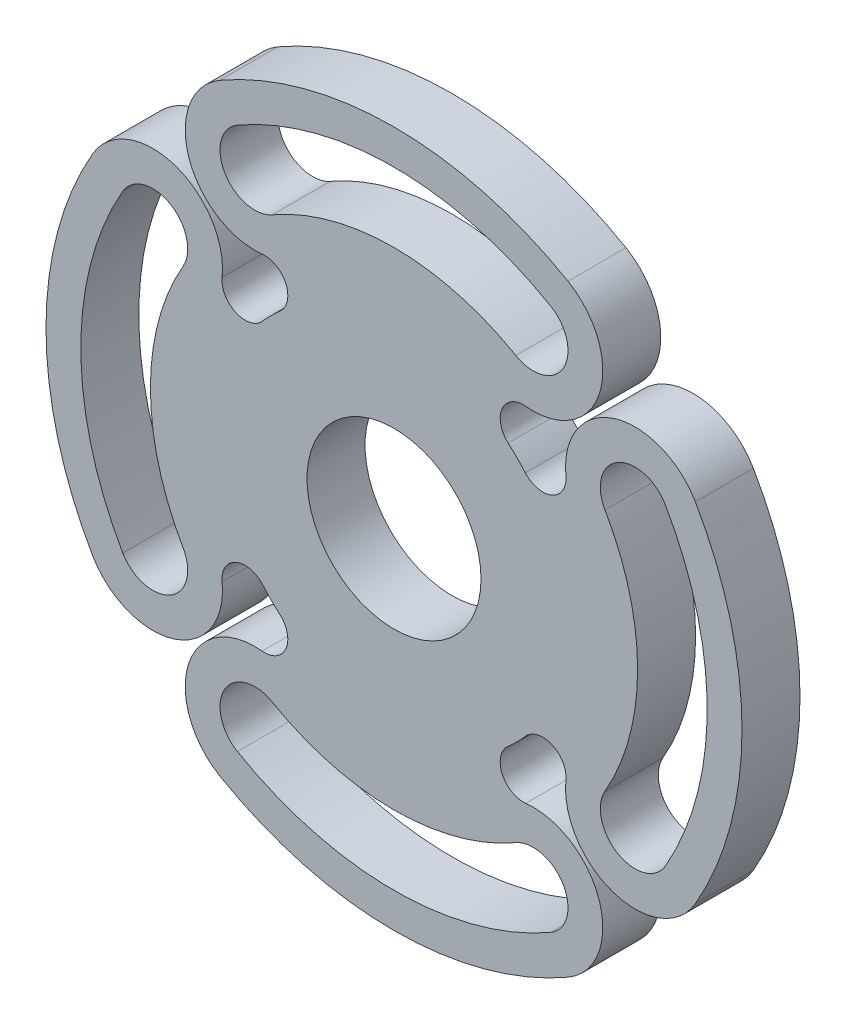
from build123d import *

# Parameters (mm, degrees)
SKETCH2_R           = 15
BOSS_EXTRUDE1_DEPTH = 5


with BuildPart() as part:
    # Sketch2 → Boss-Extrude1 (new, symmetric)
    with BuildSketch(Plane.XY):
        with BuildLine():
            ThreePointArc((-22.73046694, 29.636563105), (-18.64010484, 27.256433461), (-19.682902282, 22.640303835))
            ThreePointArc((-19.682902282, 22.640303835), (-21.213203436, 21.213203436), (-22.640303835, 19.682902282))
            ThreePointArc((-22.640303835, 19.682902282), (-27.256433461, 18.64010484), (-29.636563105, 22.73046694))
            ThreePointArc((-29.636563105, 22.73046694), (-37.853751933, 35.41031558), (-51.961524227, 30))
            ThreePointArc((-51.961524227, 30), (-60, 0), (-51.961524227, -30))
            ThreePointArc((-51.961524227, -30), (-37.853751933, -35.41031558), (-29.636563105, -22.73046694))
            ThreePointArc((-29.636563105, -22.73046694), (-27.256433461, -18.64010484), (-22.640303835, -19.682902282))
            ThreePointArc((-22.640303835, -19.682902282), (-21.213203436, -21.213203436), (-19.682902282, -22.640303835))
            ThreePointArc((-19.682902282, -22.640303835), (-18.64010484, -27.256433461), (-22.73046694, -29.636563105))
            ThreePointArc((-22.73046694, -29.636563105), (-35.41031558, -37.853751933), (-30, -51.961524227))
            ThreePointArc((-30, -51.961524227), (0, -60), (30, -51.961524227))
            ThreePointArc((30, -51.961524227), (35.41031558, -37.853751933), (22.73046694, -29.636563105))
            ThreePointArc((22.73046694, -29.636563105), (18.64010484, -27.256433461), (19.682902282, -22.640303835))
            ThreePointArc((19.682902282, -22.640303835), (21.213203436, -21.213203436), (22.640303835, -19.682902282))
            ThreePointArc((22.640303835, -19.682902282), (27.256433461, -18.64010484), (29.636563105, -22.73046694))
            ThreePointArc((29.636563105, -22.73046694), (37.853751933, -35.41031558), (51.961524227, -30))
            ThreePointArc((51.961524227, -30), (60, 0), (51.961524227, 30))
            ThreePointArc((51.961524227, 30), (37.853751933, 35.41031558), (29.636563105, 22.73046694))
            ThreePointArc((29.636563105, 22.73046694), (27.256433461, 18.64010484), (22.640303835, 19.682902282))
            ThreePointArc((22.640303835, 19.682902282), (21.213203436, 21.213203436), (19.682902282, 22.640303835))
            ThreePointArc((19.682902282, 22.640303835), (18.64010484, 27.256433461), (22.73046694, 29.636563105))
            ThreePointArc((22.73046694, 29.636563105), (35.41031558, 37.853751933), (30, 51.961524227))
            ThreePointArc((30, 51.961524227), (0, 60), (-30, 51.961524227))
            ThreePointArc((-30, 51.961524227), (-35.41031558, 37.853751933), (-22.73046694, 29.636563105))
        make_face()
        Circle(SKETCH2_R, mode=Mode.SUBTRACT)
        with BuildLine():
            ThreePointArc((-21, 36.373066959), (-29.196152423, 38.569219382), (-27, 46.765371804))
            ThreePointArc((-27, 46.765371804), (0, 54), (27, 46.765371804))
            ThreePointArc((27, 46.765371804), (29.196152423, 38.569219382), (21, 36.373066959))
            ThreePointArc((21, 36.373066959), (0, 42), (-21, 36.373066959))
        make_face(mode=Mode.SUBTRACT)
        with BuildLine():
            ThreePointArc((-46.765371804, 27), (-38.569219382, 29.196152423), (-36.373066959, 21))
            ThreePointArc((-36.373066959, 21), (-42, 0), (-36.373066959, -21))
            ThreePointArc((-36.373066959, -21), (-38.569219382, -29.196152423), (-46.765371804, -27))
            ThreePointArc((-46.765371804, -27), (-54, 0), (-46.765371804, 27))
        make_face(mode=Mode.SUBTRACT)
        with BuildLine():
            ThreePointArc((46.765371804, -27), (38.569219382, -29.196152423), (36.373066959, -21))
            ThreePointArc((36.373066959, -21), (42, 0), (36.373066959, 21))
            ThreePointArc((36.373066959, 21), (38.569219382, 29.196152423), (46.765371804, 27))
            ThreePointArc((46.765371804, 27), (54, 0), (46.765371804, -27))
        make_face(mode=Mode.SUBTRACT)
        with BuildLine():
            ThreePointArc((-27, -46.765371804), (-29.196152423, -38.569219382), (-21, -36.373066959))
            ThreePointArc((-21, -36.373066959), (0, -42), (21, -36.373066959))
            ThreePointArc((21, -36.373066959), (29.196152423, -38.569219382), (27, -46.765371804))
            ThreePointArc((27, -46.765371804), (0, -54), (-27, -46.765371804))
        make_face(mode=Mode.SUBTRACT)
    extrude(amount=BOSS_EXTRUDE1_DEPTH, both=True)


solid = part.part
